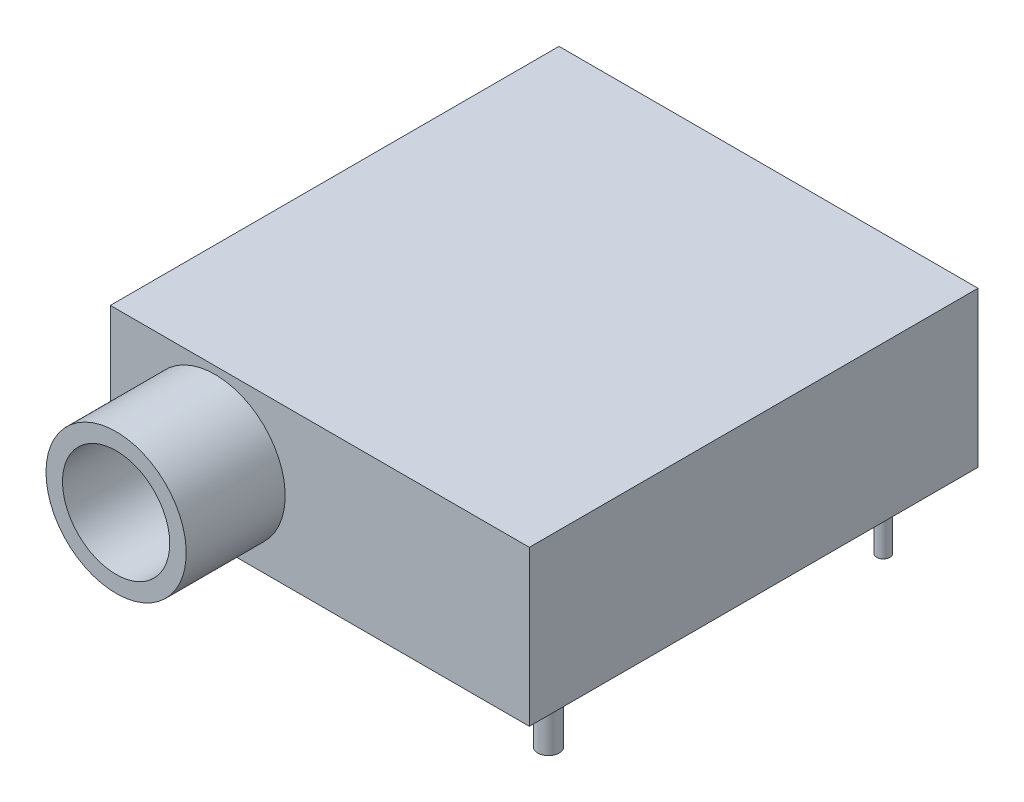
from build123d import *

# Parameters (mm, degrees)
EXTRUDE_1_DEPTH      = 4.7
EXTRUDE_1_DEPTH_BACK = 4.7
SKETCH_1_W           = 25.4
SKETCH_1_H           = 27.2
SKETCH_2_R           = 4.25
EXTRUDE_2_DEPTH      = 6
SKETCH_3_R           = 3.25
CUT_EXTRUDE_1_DEPTH  = 5
SKETCH_4_R           = 0.65
SKETCH_4_R_2         = 0.4
EXTRUDE_3_DEPTH      = 4.2


with BuildPart() as part:
    # 草图1 → 凸台-拉伸1 (new, two sides: drawn at the far end of the back side and taken through both)
    with BuildSketch(Plane(origin=(0, 0, 0), x_dir=(1, 0, 0), z_dir=(0, 1, 0)).offset(-EXTRUDE_1_DEPTH_BACK)):
        Rectangle(SKETCH_1_W, SKETCH_1_H)
    extrude(amount=EXTRUDE_1_DEPTH + EXTRUDE_1_DEPTH_BACK)

    # 草图2 → 凸台-拉伸2 (add)
    with BuildSketch(Plane.XY.offset(13.6)):
        with Locations(Location((-6.35, 0, 0), (0, 0, 180))):
            Circle(SKETCH_2_R)
    extrude(amount=EXTRUDE_2_DEPTH)

    # 草图3 → 切除-拉伸1 (cut)
    with BuildSketch(Plane.XY.offset(19.6)):
        with Locations((-6.35, 0)):
            Circle(SKETCH_3_R)
    extrude(amount=-CUT_EXTRUDE_1_DEPTH, mode=Mode.SUBTRACT)

    # 草图4 → 凸台-拉伸3 (add)
    with BuildSketch(Plane.XZ.offset(4.7)):
        with Locations(Location((-10.16, 9.9, 0), (0, 0, 90))):
            Circle(SKETCH_4_R)
        with Locations(Location((10.16, 9.9, 0), (0, 0, 90))):
            Circle(SKETCH_4_R)
        with Locations(Location((-10.16, -10.4, 0), (0, 0, 90))):
            Circle(SKETCH_4_R_2)
        with Locations(Location((-7.62, -10.4, 0), (0, 0, 90))):
            Circle(SKETCH_4_R_2)
        with Locations(Location((-5.08, -10.4, 0), (0, 0, 90))):
            Circle(SKETCH_4_R_2)
        with Locations(Location((-2.54, -10.4, 0), (0, 0, 90))):
            Circle(SKETCH_4_R_2)
        with Locations(Location((0, -10.4, 0), (0, 0, 90))):
            Circle(SKETCH_4_R_2)
        with Locations(Location((2.54, -10.4, 0), (0, 0, 90))):
            Circle(SKETCH_4_R_2)
        with Locations(Location((5.08, -10.4, 0), (0, 0, 90))):
            Circle(SKETCH_4_R_2)
        with Locations(Location((7.62, -10.4, 0), (0, 0, 90))):
            Circle(SKETCH_4_R_2)
        with Locations(Location((10.16, -10.4, 0), (0, 0, 90))):
            Circle(SKETCH_4_R_2)
    extrude(amount=EXTRUDE_3_DEPTH)


solid = part.part
